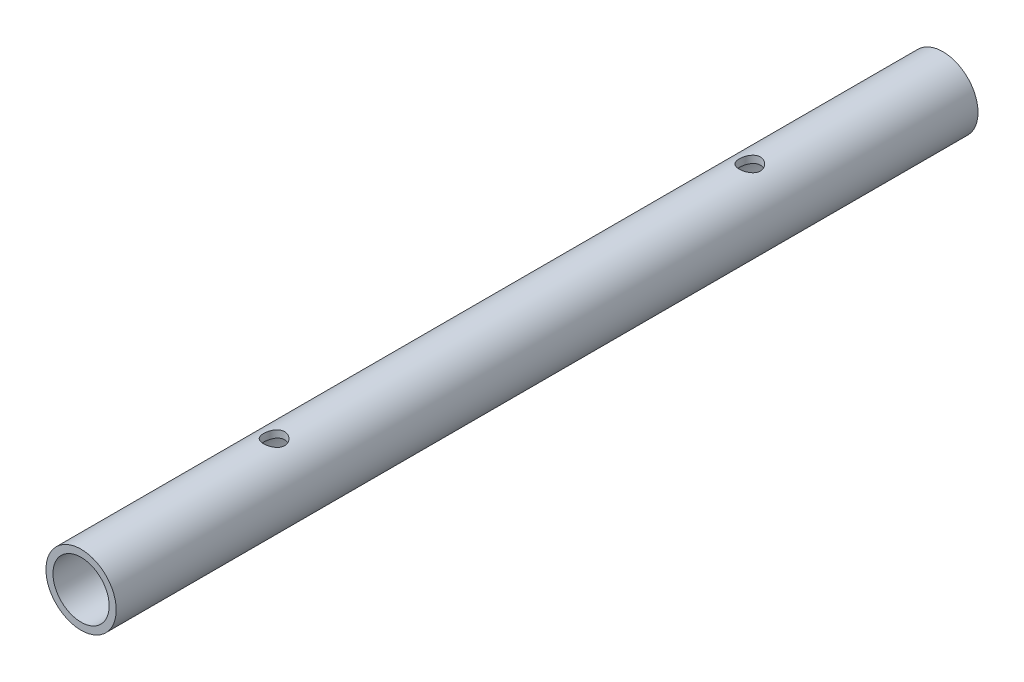
from build123d import *

# Parameters (mm, degrees)
SKETCH1_R               = 5
BOSS_EXTRUDE1_DEPTH     = 122.638
CUT_EXTRUDE1_REACH      = 124.842
SKETCH2_R               = 4
CUT_EXTRUDE2_DEPTH      = 123.841682844
CUT_EXTRUDE2_DEPTH_BACK = 123.841682844
SKETCH5_R               = 1.5


with BuildPart() as part:
    # Sketch1 → Boss-Extrude1 (new body)
    with BuildSketch(Plane.XY):
        Circle(SKETCH1_R)
    extrude(amount=BOSS_EXTRUDE1_DEPTH)

    # Sketch2 → Cut-Extrude1 (cut, up to next)
    with BuildSketch(Plane.XY.offset(122.638), mode=Mode.PRIVATE) as cut_extrude1_sk1:
        Circle(SKETCH2_R)
    cut_extrude1_tool1 = extrude(cut_extrude1_sk1.sketch, amount=-CUT_EXTRUDE1_REACH, mode=Mode.PRIVATE) & part.part
    add(cut_extrude1_tool1.solids().sort_by_distance((0, 0, 122.638))[0], mode=Mode.SUBTRACT)

    # Sketch5 → Cut-Extrude2 (cut, two sides: drawn at the far end of the back side and taken through both)
    with BuildSketch(Plane(origin=(0, 0, 0), x_dir=(1, 0, 0), z_dir=(0, 1, 0)).offset(-CUT_EXTRUDE2_DEPTH_BACK)):
        with Locations(Location((0, -27.471, 0), (0, 0, 270))):
            Circle(SKETCH5_R)
        with Locations(Location((0, -95.167, 0), (0, 0, 270))):
            Circle(SKETCH5_R)
    extrude(amount=CUT_EXTRUDE2_DEPTH + CUT_EXTRUDE2_DEPTH_BACK, mode=Mode.SUBTRACT)


solid = part.part
